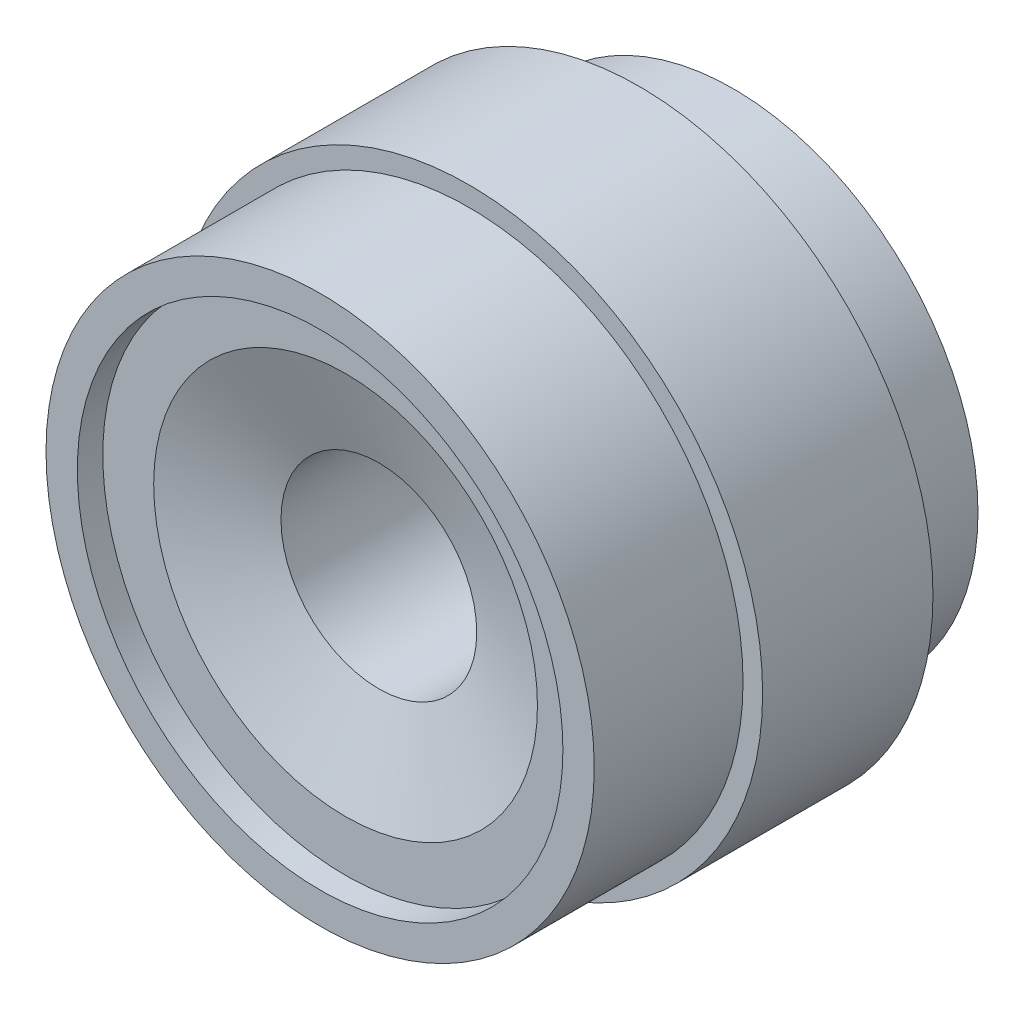
from build123d import *

# Parameters (mm, degrees)
SKETCH_1_R          = 12.5
EXTRUDE_1_DEPTH     = 4.8
SKETCH_2_R          = 15
EXTRUDE_2_DEPTH     = 8.7
SKETCH_3_R          = 14
EXTRUDE_3_DEPTH     = 7.6
SKETCH_6_R          = 5
CUT_EXTRUDE_1_DEPTH = 28.885659397


with BuildPart() as part:
    # 스케치1 → 보스-돌출1 (new body)
    with BuildSketch(Plane.XY):
        Circle(SKETCH_1_R)
    extrude(amount=EXTRUDE_1_DEPTH)

    # 스케치2 → 보스-돌출2 (add)
    with BuildSketch(Plane.XY.offset(4.8)):
        Circle(SKETCH_2_R)
    extrude(amount=EXTRUDE_2_DEPTH)

    # 스케치3 → 보스-돌출3 (add)
    with BuildSketch(Plane.XY.offset(13.5)):
        with Locations(Location((0, 0, 0), (0, 0, 180))):
            Circle(SKETCH_3_R)
    extrude(amount=EXTRUDE_3_DEPTH)

    # 스케치5 → 컷-회전1 (revolve, cut)
    with BuildSketch(Plane(origin=(0, 0, 0), x_dir=(1, 0, 0), z_dir=(0, 1, 0))):
        Polygon((0, -18.1), (5, -18.1), (9.8, -19.8), (12.4, -19.8), (12.4, -21.829479187), (0, -21.829479187), align=None)
    revolve(axis=Axis((0, 0, 21.829479187), (0, 0, -1)), mode=Mode.SUBTRACT)

    # 스케치6 → 컷-돌출1 (cut, through all)
    with BuildSketch(Plane.XY.offset(18.1)):
        Circle(SKETCH_6_R)
    extrude(amount=-CUT_EXTRUDE_1_DEPTH, mode=Mode.SUBTRACT)


solid = part.part
